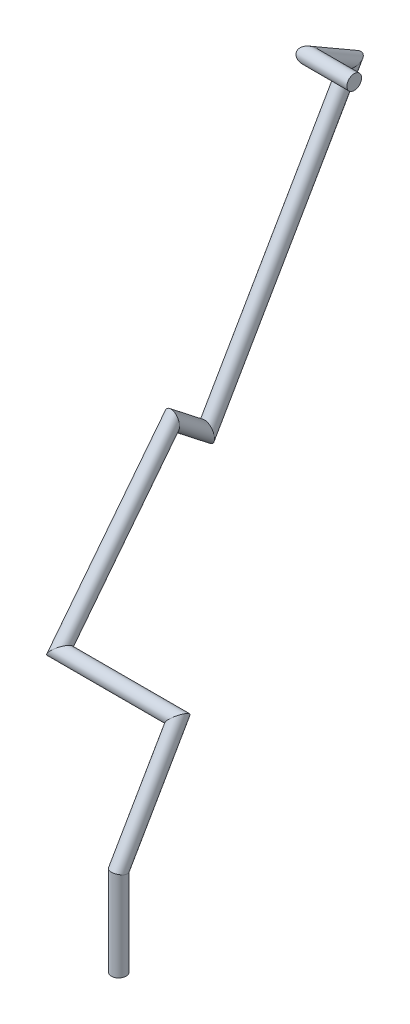
from build123d import *

# Parameters (mm, degrees)
SWEEP1_PROFILE_R = 2.5


with BuildPart() as part:
    # Sweep1: sweep along a curve in space
    with BuildLine() as sweep1_path:
        Line((0, 0, 0), (0, 30, 0))
        Line((0, 30, 0), (0, 64.641016151, -20))
        Line((0, 64.641016151, -20), (-40, 64.641016151, -20))
        Line((-40, 64.641016151, -20), (-40, 113.497682875, -58.17101147))
        Line((-40, 113.497682875, -58.17101147), (-40, 104.262760745, -69.991172774))
        Line((-40, 104.262760745, -69.991172774), (-40, 189.133250316, -118.991172774))
        Line((-40, 189.133250316, -118.991172774), (-40, 197.133250316, -105.134766314))
        Line((-40, 197.133250316, -105.134766314), (-25, 197.133250316, -105.134766314))
    # Sweep1 profile (on start of the path) → Sweep1 (sweep)
    with BuildSketch(Plane.ZX):
        Circle(SWEEP1_PROFILE_R)
    sweep(path=sweep1_path.line, transition=Transition.RIGHT)


solid = part.part
